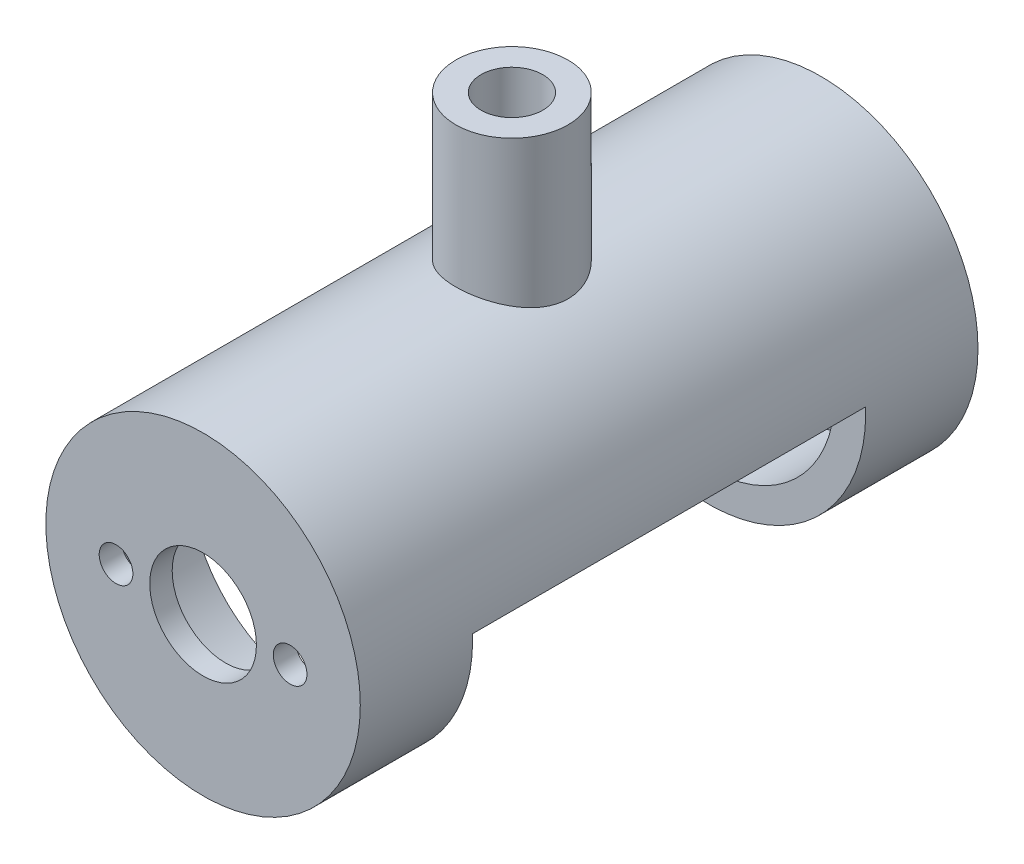
from build123d import *
from build123d.topology import SkipClean

# Parameters (mm, degrees)
CROQUIS7_R                    = 5
CROQUIS7_R_2                  = 2.5
SALIENTE_EXTRUIR7_DEPTH       = 13
SALIENTE_EXTRUIR8_DEPTH       = 20
SALIENTE_EXTRUIR8_DEPTH_BACK  = 20
CROQUIS8_R                    = 6.5
CROQUIS8_R_2                  = 4
SALIENTE_EXTRUIR10_START      = -16
CROQUIS9_R                    = 5
CROQUIS9_R_2                  = 2.5
SALIENTE_EXTRUIR10_DEPTH      = 16
CROQUIS10_R                   = 4
CORTAR_EXTRUIR1_DEPTH         = 43
CROQUIS11_W                   = 2
CROQUIS11_H                   = 5.07
CORTAR_EXTRUIR2_DEPTH         = 43
CROQUIS12_W                   = 2.5
CROQUIS12_H                   = 8.55
SALIENTE_EXTRUIR11_DEPTH      = 40
CROQUIS13_W                   = 2.5
CROQUIS13_H                   = 8.55
SALIENTE_EXTRUIR12_DEPTH      = 40
CROQUIS14_R                   = 1.5
CORTAR_EXTRUIR3_DEPTH         = 40
CROQUIS15_W                   = 25.103350224
CROQUIS15_H                   = 20.011454976
CORTAR_EXTRUIR4_DEPTH         = 40
SALIENTE_EXTRUIR14_DEPTH      = 55
SALIENTE_EXTRUIR14_DEPTH_BACK = 55
CROQUIS16_R                   = 13.5
CROQUIS16_R_2                 = 11
SALIENTE_EXTRUIR15_START      = -15
CROQUIS17_R                   = 5
CROQUIS17_R_2                 = 2.5
SALIENTE_EXTRUIR15_DEPTH      = 15
CROQUIS18_R                   = 11
CROQUIS18_R_2                 = 4.25
SALIENTE_EXTRUIR16_DEPTH      = 3
CROQUIS20_R                   = 1.5
CORTAR_EXTRUIR5_DEPTH         = 3
SALIENTE_EXTRUIR17_START      = -3
CROQUIS21_R                   = 11
CROQUIS21_R_2                 = 4.25
CROQUIS21_R_3                 = 1.5
CROQUIS21_R_4                 = 1.386293428
SALIENTE_EXTRUIR17_DEPTH      = 3
CORTAR_EXTRUIR6_DEPTH         = 31
CORTAR_EXTRUIR6_DEPTH_BACK    = 18
CROQUIS22_W                   = 90
CROQUIS22_H                   = 14
CROQUIS24_R                   = 13.5
CORTAR_EXTRUIR7_DEPTH         = 27.5
CROQUIS27_R                   = 13.5
CROQUIS27_R_2                 = 11
SALIENTE_EXTRUIR19_DEPTH      = 10
CROQUIS28_R                   = 11
CROQUIS28_R_2                 = 1.5
CROQUIS28_R_3                 = 4.25
SALIENTE_EXTRUIR20_DEPTH      = 3
CORTAR_EXTRUIR8_START         = -27.5
CROQUIS29_R                   = 13.5
CORTAR_EXTRUIR8_DEPTH         = 27.5
SALIENTE_EXTRUIR21_START      = -10
CROQUIS30_R                   = 13.5
CROQUIS30_R_2                 = 11
SALIENTE_EXTRUIR21_DEPTH      = 10
SALIENTE_EXTRUIR22_START      = -3
CROQUIS31_R                   = 11
CROQUIS31_R_2                 = 4.25
CROQUIS31_R_3                 = 1.5
SALIENTE_EXTRUIR22_DEPTH      = 3
CROQUIS32_R                   = 14
CROQUIS32_R_2                 = 13.5
SALIENTE_EXTRUIR25_DEPTH      = 10
SALIENTE_EXTRUIR26_START      = -10
CROQUIS35_R                   = 14
CROQUIS35_R_2                 = 13.5
SALIENTE_EXTRUIR26_DEPTH      = 10
SALIENTE_EXTRUIR27_START      = -47
SALIENTE_EXTRUIR27_DEPTH      = 47
CORTAR_EXTRUIR9_DEPTH         = 43
CORTAR_EXTRUIR9_DEPTH_BACK    = 8
CROQUIS37_R                   = 11.75
CORTAR_EXTRUIR10_START        = -12
CROQUIS38_R                   = 2.75
CROQUIS38_R_2                 = 2.5
CORTAR_EXTRUIR10_DEPTH        = 12
CROQUIS39_R                   = 4.75
CORTAR_EXTRUIR11_DEPTH        = 64
CROQUIS41_R                   = 11.75
CROQUIS41_R_2                 = 11.125
SALIENTE_EXTRUIR28_DEPTH      = 10
SALIENTE_EXTRUIR29_START      = -10
CROQUIS42_R                   = 11.75
CROQUIS42_R_2                 = 11.125
SALIENTE_EXTRUIR29_DEPTH      = 10
SALIENTE_EXTRUIR30_START      = -10
CROQUIS43_R                   = 11.125
CROQUIS43_R_2                 = 11
SALIENTE_EXTRUIR30_DEPTH      = 10
CROQUIS45_R                   = 11.125
CROQUIS45_R_2                 = 11
SALIENTE_EXTRUIR31_DEPTH      = 10
CROQUIS46_W                   = 9.066588381
CROQUIS46_H                   = 35
CROQUIS46_W_2                 = 4.04
CORTAR_EXTRUIR12_DEPTH        = 11
CROQUIS47_R                   = 11.25
CORTAR_EXTRUIR13_DEPTH        = 8
CORTAR_EXTRUIR14_START        = -8
CROQUIS48_R                   = 11.25
CORTAR_EXTRUIR14_DEPTH        = 8


with BuildPart() as part:
    # Croquis7 → Saliente-Extruir7 (new body)
    with BuildSketch(Plane(origin=(0, 0, 0), x_dir=(1, 0, 0), z_dir=(0, 1, 0))):
        with Locations(Location((0, 0, 0), (0, 0, 90))):
            Circle(CROQUIS7_R)
        with Locations(Location((0, 0, 0), (0, 0, 90))):
            Circle(CROQUIS7_R_2, mode=Mode.SUBTRACT)
    extrude(amount=SALIENTE_EXTRUIR7_DEPTH)



with BuildPart() as body_2:
    # Croquis8 → Saliente-Extruir8 (new, two sides: drawn at the far end of the back side and taken through both)
    with BuildSketch(Plane.XY.offset(-SALIENTE_EXTRUIR8_DEPTH_BACK)):
        with Locations((0, -6.5)):
            Circle(CROQUIS8_R)
        with Locations((0, -6.5)):
            Circle(CROQUIS8_R_2, mode=Mode.SUBTRACT)
    extrude(amount=SALIENTE_EXTRUIR8_DEPTH + SALIENTE_EXTRUIR8_DEPTH_BACK)


with BuildPart() as part_1:
    add(part.part)

    add(body_2.part)  # Saliente-Extruir10 merges body 2
    # Croquis9 → Saliente-Extruir10 (add)
    with BuildSketch(Plane(origin=(0, 13, 0), x_dir=(1, 0, 0), z_dir=(0, 1, 0)).offset(SALIENTE_EXTRUIR10_START)):
        with Locations(Location((0, 0, 0), (0, 0, 90))):
            Circle(CROQUIS9_R)
        with Locations(Location((0, 0, 0), (0, 0, 90))):
            Circle(CROQUIS9_R_2, mode=Mode.SUBTRACT)
    extrude(amount=SALIENTE_EXTRUIR10_DEPTH)

    # Croquis10 → Cortar-Extruir1 (cut)
    with BuildSketch(Plane.XY.offset(20)):
        with Locations((0, -6.5)):
            Circle(CROQUIS10_R)
    extrude(amount=-CORTAR_EXTRUIR1_DEPTH, mode=Mode.SUBTRACT)

    # Croquis11 → Cortar-Extruir2 (cut)
    with BuildSketch(Plane.XY.offset(20)):
        with Locations((0, -11.747658627)):
            Rectangle(CROQUIS11_W, CROQUIS11_H)
    extrude(amount=-CORTAR_EXTRUIR2_DEPTH, mode=Mode.SUBTRACT)

    # Croquis12 → Saliente-Extruir11 (add)
    with BuildSketch(Plane(origin=(0, 0, -20), x_dir=(-1, 0, 0), z_dir=(0, 0, -1))):
        with Locations((-2.25, -14.647983346)):
            Rectangle(CROQUIS12_W, CROQUIS12_H)
    extrude(amount=-SALIENTE_EXTRUIR11_DEPTH)

    # Croquis13 → Saliente-Extruir12 (add)
    with BuildSketch(Plane(origin=(0, 0, -20), x_dir=(-1, 0, 0), z_dir=(0, 0, -1))):
        with Locations((2.25, -14.647983346)):
            Rectangle(CROQUIS13_W, CROQUIS13_H)
    extrude(amount=-SALIENTE_EXTRUIR12_DEPTH)

    # Croquis14 → Cortar-Extruir3 (cut)
    with BuildSketch(Plane.ZY.offset(3.5)):
        with Locations((-13, -15.450104461)):
            Circle(CROQUIS14_R)
        with Locations((0, -15.450104461)):
            Circle(CROQUIS14_R)
        with Locations((13, -15.450104461)):
            Circle(CROQUIS14_R)
    extrude(amount=-CORTAR_EXTRUIR3_DEPTH, mode=Mode.SUBTRACT)

    # Croquis15 → Cortar-Extruir4 (cut)
    with BuildSketch(Plane.XY.offset(20)):
        with Locations((-2.902121413, -10.005727488)):
            Rectangle(CROQUIS15_W, CROQUIS15_H)
    extrude(amount=-CORTAR_EXTRUIR4_DEPTH, mode=Mode.SUBTRACT)



with BuildPart() as body_2_2:
    # Croquis16 → Saliente-Extruir14 (new, two sides: drawn at the far end of the back side and taken through both)
    with BuildSketch(Plane.XY.offset(-SALIENTE_EXTRUIR14_DEPTH_BACK)):
        with Locations((0, -13.5)):
            Circle(CROQUIS16_R)
        with Locations((0, -13.5)):
            Circle(CROQUIS16_R_2, mode=Mode.SUBTRACT)
    extrude(amount=SALIENTE_EXTRUIR14_DEPTH + SALIENTE_EXTRUIR14_DEPTH_BACK)


with BuildPart() as part_2:
    add(part_1.part)

    add(body_2_2.part)  # Saliente-Extruir15 merges body 2 2
    # Croquis17 → Saliente-Extruir15 (add)
    with BuildSketch(Plane(origin=(0, 13, 0), x_dir=(1, 0, 0), z_dir=(0, 1, 0)).offset(SALIENTE_EXTRUIR15_START)):
        with Locations(Location((0, 0, 0), (0, 0, 90))):
            Circle(CROQUIS17_R)
        with Locations(Location((0, 0, 0), (0, 0, 90))):
            Circle(CROQUIS17_R_2, mode=Mode.SUBTRACT)
    extrude(amount=SALIENTE_EXTRUIR15_DEPTH)

    # Croquis18 → Saliente-Extruir16 (add)
    with BuildSketch(Plane(origin=(0, 0, -55), x_dir=(-1, 0, 0), z_dir=(0, 0, -1))):
        with Locations((0, -13.5)):
            Circle(CROQUIS18_R)
        with Locations((0, -13.5)):
            Circle(CROQUIS18_R_2, mode=Mode.SUBTRACT)
    extrude(amount=-SALIENTE_EXTRUIR16_DEPTH)

    # Croquis20 → Cortar-Extruir5 (cut)
    with BuildSketch(Plane(origin=(0, 0, -55), x_dir=(-1, 0, 0), z_dir=(0, 0, -1))):
        with Locations((-7.75, -13.5)):
            Circle(CROQUIS20_R)
        with Locations((7.75, -13.5)):
            Circle(CROQUIS20_R)
    extrude(amount=-CORTAR_EXTRUIR5_DEPTH, mode=Mode.SUBTRACT)

    # Croquis21 → Saliente-Extruir17 (add)
    with BuildSketch(Plane.XY.offset(55).offset(SALIENTE_EXTRUIR17_START)):
        with Locations(Location((0, -13.5, 0), (0, 0, 180))):
            Circle(CROQUIS21_R)
        with Locations(Location((0, -13.5, 0), (0, 0, 180))):
            Circle(CROQUIS21_R_2, mode=Mode.SUBTRACT)
        with Locations(Location((7.75, -13.5, 0), (0, 0, 180))):
            Circle(CROQUIS21_R_3, mode=Mode.SUBTRACT)
        with Locations((-7.75, -13.5)):
            Circle(CROQUIS21_R_4, mode=Mode.SUBTRACT)
    extrude(amount=SALIENTE_EXTRUIR17_DEPTH)

    # Croquis22 → Cortar-Extruir6 (cut, two sides: drawn at the far end of the back side and taken through both)
    with BuildSketch(Plane(origin=(0, 0, 0), x_dir=(0, 0, -1), z_dir=(1, 0, 0)).offset(-CORTAR_EXTRUIR6_DEPTH_BACK)):
        with Locations((0, -20)):
            Rectangle(CROQUIS22_W, CROQUIS22_H)
    extrude(amount=CORTAR_EXTRUIR6_DEPTH + CORTAR_EXTRUIR6_DEPTH_BACK, mode=Mode.SUBTRACT)

    # Croquis24 → Cortar-Extruir7 (cut)
    with BuildSketch(Plane.XY.offset(55)):
        with Locations(Location((0, -13.5, 0), (0, 0, 177.877448638))):
            Circle(CROQUIS24_R)
    extrude(amount=-CORTAR_EXTRUIR7_DEPTH, mode=Mode.SUBTRACT)

    # Croquis27 → Saliente-Extruir19 (add)
    with BuildSketch(Plane.XY.offset(27.5)):
        with Locations((0, -13.5)):
            Circle(CROQUIS27_R)
        with Locations(Location((0, -13.5, 0), (0, 0, 180))):
            Circle(CROQUIS27_R_2, mode=Mode.SUBTRACT)
    extrude(amount=-SALIENTE_EXTRUIR19_DEPTH)

    # Croquis28 → Saliente-Extruir20 (add)
    with BuildSketch(Plane.XY.offset(27.5)):
        with Locations(Location((0, -13.5, 0), (0, 0, 180))):
            Circle(CROQUIS28_R)
        with Locations(Location((-7.75, -13.5, 0), (0, 0, 180))):
            Circle(CROQUIS28_R_2, mode=Mode.SUBTRACT)
        with Locations(Location((7.75, -13.5, 0), (0, 0, 180))):
            Circle(CROQUIS28_R_2, mode=Mode.SUBTRACT)
        with Locations(Location((0, -13.5, 0), (0, 0, 180))):
            Circle(CROQUIS28_R_3, mode=Mode.SUBTRACT)
    extrude(amount=-SALIENTE_EXTRUIR20_DEPTH)

    # Croquis29 → Cortar-Extruir8 (cut)
    with BuildSketch(Plane(origin=(0, 0, -55), x_dir=(-1, 0, 0), z_dir=(0, 0, -1)).offset(CORTAR_EXTRUIR8_START)):
        with Locations(Location((0, -13.5, 0), (0, 0, 2.122551362))):
            Circle(CROQUIS29_R)
    extrude(amount=CORTAR_EXTRUIR8_DEPTH, mode=Mode.SUBTRACT)

    # Croquis30 → Saliente-Extruir21 (add)
    with BuildSketch(Plane(origin=(0, 0, -27.5), x_dir=(-1, 0, 0), z_dir=(0, 0, -1)).offset(SALIENTE_EXTRUIR21_START)):
        with Locations((0, -13.5)):
            Circle(CROQUIS30_R)
        with Locations((0, -13.5)):
            Circle(CROQUIS30_R_2, mode=Mode.SUBTRACT)
    extrude(amount=SALIENTE_EXTRUIR21_DEPTH)

    # Croquis31 → Saliente-Extruir22 (add)
    with BuildSketch(Plane(origin=(0, 0, -27.5), x_dir=(-1, 0, 0), z_dir=(0, 0, -1)).offset(SALIENTE_EXTRUIR22_START)):
        with Locations((0, -13.5)):
            Circle(CROQUIS31_R)
        with Locations(Location((0, -13.5, 0), (0, 0, 180))):
            Circle(CROQUIS31_R_2, mode=Mode.SUBTRACT)
        with Locations(Location((7.75, -13.5, 0), (0, 0, 180))):
            Circle(CROQUIS31_R_3, mode=Mode.SUBTRACT)
        with Locations(Location((-7.75, -13.5, 0), (0, 0, 180))):
            Circle(CROQUIS31_R_3, mode=Mode.SUBTRACT)
    extrude(amount=SALIENTE_EXTRUIR22_DEPTH)

    # Croquis32 → Saliente-Extruir25 (add)
    with BuildSketch(Plane.XY.offset(27.5)):
        with Locations((0, -13.5)):
            Circle(CROQUIS32_R)
        with Locations(Location((0, -13.5, 0), (0, 0, 180))):
            Circle(CROQUIS32_R_2, mode=Mode.SUBTRACT)
    extrude(amount=-SALIENTE_EXTRUIR25_DEPTH)

    # Croquis35 → Saliente-Extruir26 (add)
    with BuildSketch(Plane(origin=(0, 0, -27.5), x_dir=(-1, 0, 0), z_dir=(0, 0, -1)).offset(SALIENTE_EXTRUIR26_START)):
        with Locations(Location((0, -13.5, 0), (0, 0, 180))):
            Circle(CROQUIS35_R)
        with Locations((0, -13.5)):
            Circle(CROQUIS35_R_2, mode=Mode.SUBTRACT)
    extrude(amount=SALIENTE_EXTRUIR26_DEPTH)

    # Croquis36 → Saliente-Extruir27 (add)
    with BuildSketch(Plane(origin=(0, 0, -27.5), x_dir=(-1, 0, 0), z_dir=(0, 0, -1)).offset(SALIENTE_EXTRUIR27_START)):
        with BuildLine():
            Line((-14, -13.5), (-13.5, -13.5))
            ThreePointArc((-13.5, -13.5), (0, 0), (13.5, -13.5))
            Line((13.5, -13.5), (14, -13.5))
            ThreePointArc((14, -13.5), (0, 0.5), (-14, -13.5))
        make_face()
    extrude(amount=SALIENTE_EXTRUIR27_DEPTH)

    # Croquis37 → Cortar-Extruir9 (cut, two sides: drawn at the far end of the back side and taken through both)
    with BuildSketch(Plane(origin=(0, 0, 17.5), x_dir=(-1, 0, 0), z_dir=(0, 0, -1)).offset(-CORTAR_EXTRUIR9_DEPTH_BACK)):
        with Locations((0, -13.5)):
            Circle(CROQUIS37_R)
    extrude(amount=CORTAR_EXTRUIR9_DEPTH + CORTAR_EXTRUIR9_DEPTH_BACK, mode=Mode.SUBTRACT)

    # Croquis38 → Cortar-Extruir10 (cut)
    with BuildSketch(Plane(origin=(0, 13, 0), x_dir=(1, 0, 0), z_dir=(0, 1, 0)).offset(CORTAR_EXTRUIR10_START)):
        with Locations(Location((0, 0, 0), (0, 0, 270))):
            Circle(CROQUIS38_R)
        with Locations(Location((0, 0, 0), (0, 0, 90))):
            Circle(CROQUIS38_R_2, mode=Mode.SUBTRACT)
    extrude(amount=CORTAR_EXTRUIR10_DEPTH, mode=Mode.SUBTRACT)

    # Croquis39 → Cortar-Extruir11 (cut)
    with BuildSketch(Plane.XY.offset(27.5)):
        with Locations(Location((0, -13.5, 0), (0, 0, 180))):
            Circle(CROQUIS39_R)
    extrude(amount=-CORTAR_EXTRUIR11_DEPTH, mode=Mode.SUBTRACT)

    # Croquis41 → Saliente-Extruir28 (add)
    with BuildSketch(Plane.XY.offset(-17.5)):
        with Locations(Location((0, -13.5, 0), (0, 0, 180))):
            Circle(CROQUIS41_R)
        with Locations((0, -13.5)):
            Circle(CROQUIS41_R_2, mode=Mode.SUBTRACT)
    extrude(amount=-SALIENTE_EXTRUIR28_DEPTH)

    # Croquis42 → Saliente-Extruir29 (add)
    with BuildSketch(Plane(origin=(0, 0, 17.5), x_dir=(-1, 0, 0), z_dir=(0, 0, -1)).offset(SALIENTE_EXTRUIR29_START)):
        with Locations((0, -13.5)):
            Circle(CROQUIS42_R)
        with Locations(Location((0, -13.5, 0), (0, 0, 180))):
            Circle(CROQUIS42_R_2, mode=Mode.SUBTRACT)
    extrude(amount=SALIENTE_EXTRUIR29_DEPTH)

    # Croquis43 → Saliente-Extruir30 (add)
    with BuildSketch(Plane(origin=(0, 0, 17.5), x_dir=(-1, 0, 0), z_dir=(0, 0, -1)).offset(SALIENTE_EXTRUIR30_START)):
        with Locations(Location((0, -13.5, 0), (0, 0, 180))):
            Circle(CROQUIS43_R)
        with Locations((0, -13.5)):
            Circle(CROQUIS43_R_2, mode=Mode.SUBTRACT)
    extrude(amount=SALIENTE_EXTRUIR30_DEPTH)

    # Croquis45 → Saliente-Extruir31 (add)
    with BuildSketch(Plane.XY.offset(-17.5)):
        with Locations((0, -13.5)):
            Circle(CROQUIS45_R)
        with Locations(Location((0, -13.5, 0), (0, 0, 180))):
            Circle(CROQUIS45_R_2, mode=Mode.SUBTRACT)
    extrude(amount=-SALIENTE_EXTRUIR31_DEPTH)

    # Croquis46 → Cortar-Extruir12 (cut)
    with SkipClean():  # the faces are left unmerged after this step: merging them gives an invalid solid
        with BuildSketch(Plane(origin=(0, -13, 0), x_dir=(-1, 0, 0), z_dir=(0, -1, 0))):
            with Locations((16.272651073, 0)):
                Rectangle(CROQUIS46_W, CROQUIS46_H)
            with Locations((-13.759356882, 0)):
                Rectangle(CROQUIS46_W_2, CROQUIS46_H)
        extrude(amount=CORTAR_EXTRUIR12_DEPTH, mode=Mode.SUBTRACT)

    # Croquis47 → Cortar-Extruir13 (cut)
    with SkipClean():  # the faces are left unmerged after this step: merging them gives an invalid solid
        with BuildSketch(Plane(origin=(0, 0, 17.5), x_dir=(-1, 0, 0), z_dir=(0, 0, -1))):
            with Locations((0, -13.5)):
                Circle(CROQUIS47_R)
        extrude(amount=-CORTAR_EXTRUIR13_DEPTH, mode=Mode.SUBTRACT)

    # Croquis48 → Cortar-Extruir14 (cut)
    with SkipClean():  # the faces are left unmerged after this step: merging them gives an invalid solid
        with BuildSketch(Plane.XY.offset(-17.5).offset(CORTAR_EXTRUIR14_START)):
            with Locations(Location((0, -13.5, 0), (0, 0, 180))):
                Circle(CROQUIS48_R)
        extrude(amount=CORTAR_EXTRUIR14_DEPTH, mode=Mode.SUBTRACT)


solid = part_2.part
